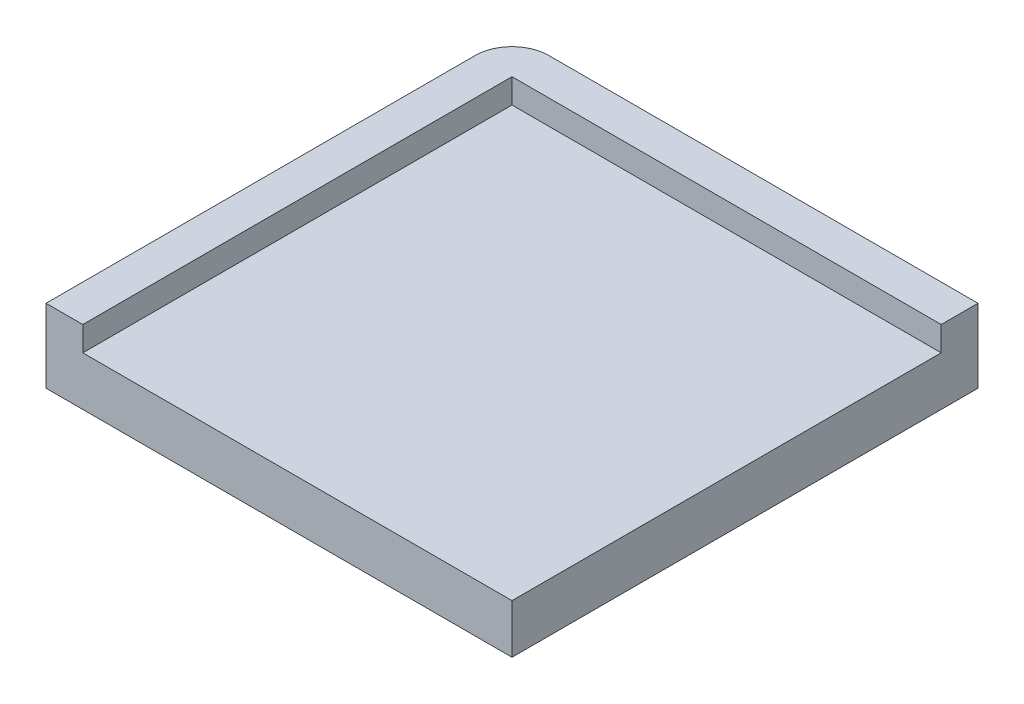
from build123d import *

# Parameters (mm, degrees)
SKETCH1_W           = 38
SKETCH1_H           = 38
BOSS_EXTRUDE1_DEPTH = 4
BOSS_EXTRUDE2_DEPTH = 2
FILLET1_R           = 3


with BuildPart() as part:
    # Sketch1 → Boss-Extrude1 (new body)
    with BuildSketch(Plane(origin=(0, 0, 0), x_dir=(1, 0, 0), z_dir=(0, 1, 0))):
        Rectangle(SKETCH1_W, SKETCH1_H)
    extrude(amount=BOSS_EXTRUDE1_DEPTH)

    # Sketch2 → Boss-Extrude2 (add)
    with BuildSketch(Plane(origin=(0, 4, 0), x_dir=(1, 0, 0), z_dir=(0, 1, 0))):
        Polygon((-16, -19), (-19, -19), (-19, 19), (19, 19), (19, 16), (-16, 16), align=None)
    extrude(amount=BOSS_EXTRUDE2_DEPTH)

    # Fillet1
    fillet1_edges = [part.edges().sort_by_distance(p)[0] for p in [
        (-19, 3, -19),
    ]]
    fillet(fillet1_edges, radius=FILLET1_R)


solid = part.part
